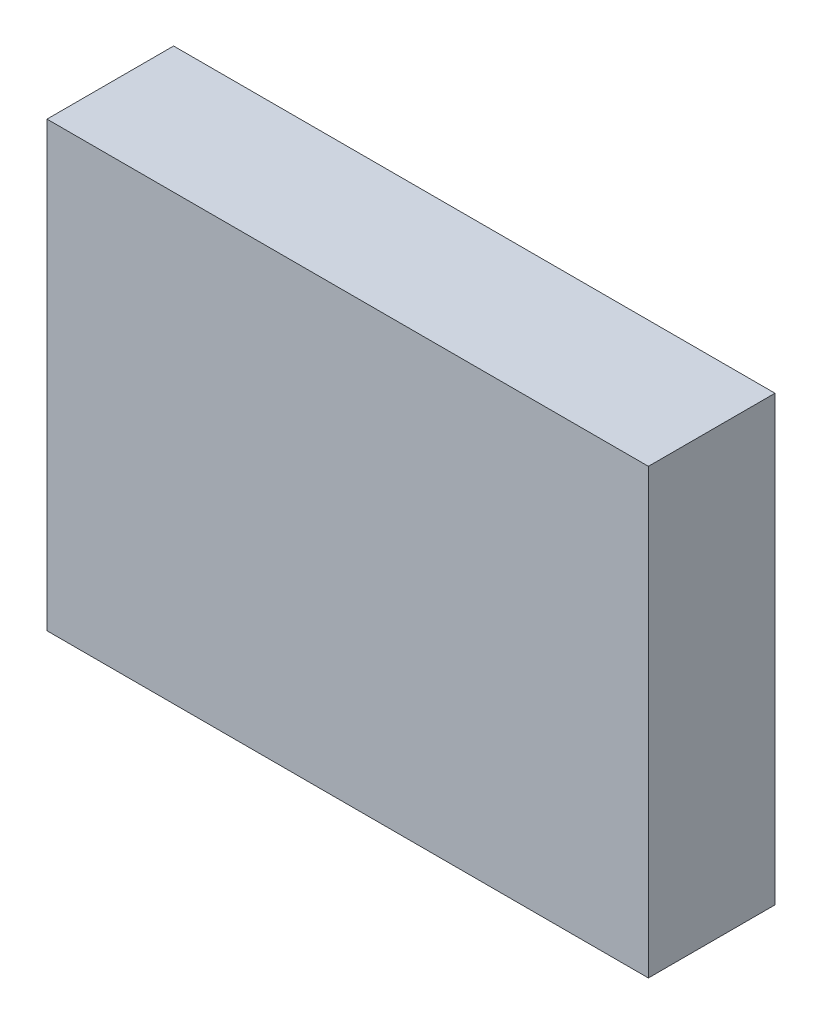
from build123d import *

# Parameters (mm, degrees)
SKETCH1_W           = 120.65
SKETCH1_H           = 88.9
BOSS_EXTRUDE1_DEPTH = 25.4


with BuildPart() as part:
    # Sketch1 → Boss-Extrude1 (new body)
    with BuildSketch(Plane.XY):
        with Locations((-21.664955057, 120.396625397)):
            Rectangle(SKETCH1_W, SKETCH1_H)
    extrude(amount=BOSS_EXTRUDE1_DEPTH)


solid = part.part
